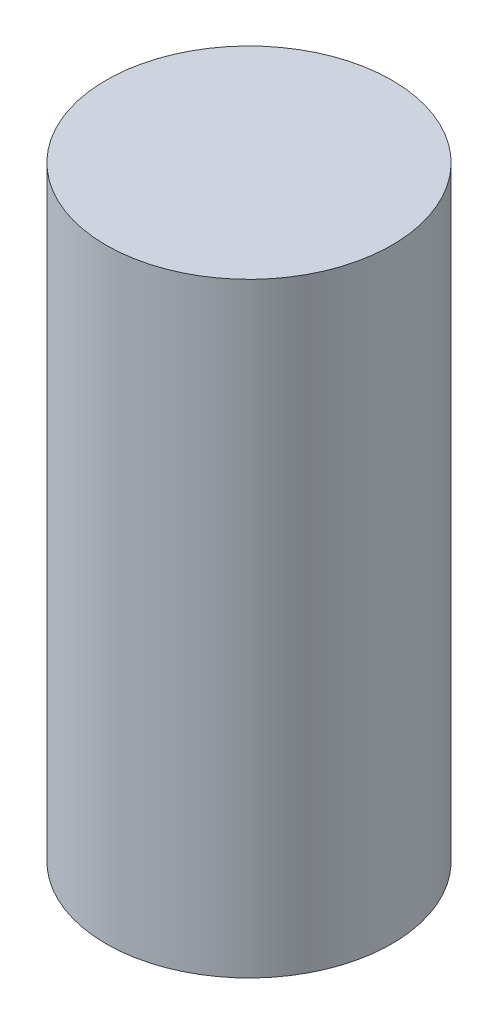
from build123d import *

# Parameters (mm, degrees)
SKETCH1_R           = 60
BOSS_EXTRUDE1_DEPTH = 254


with BuildPart() as part:
    # Sketch1 → Boss-Extrude1 (new body)
    with BuildSketch(Plane(origin=(0, 0, 0), x_dir=(1, 0, 0), z_dir=(0, 1, 0))):
        with Locations(Location((0, 0, 0), (0, 0, 270))):
            Circle(SKETCH1_R)
    extrude(amount=BOSS_EXTRUDE1_DEPTH)


solid = part.part
